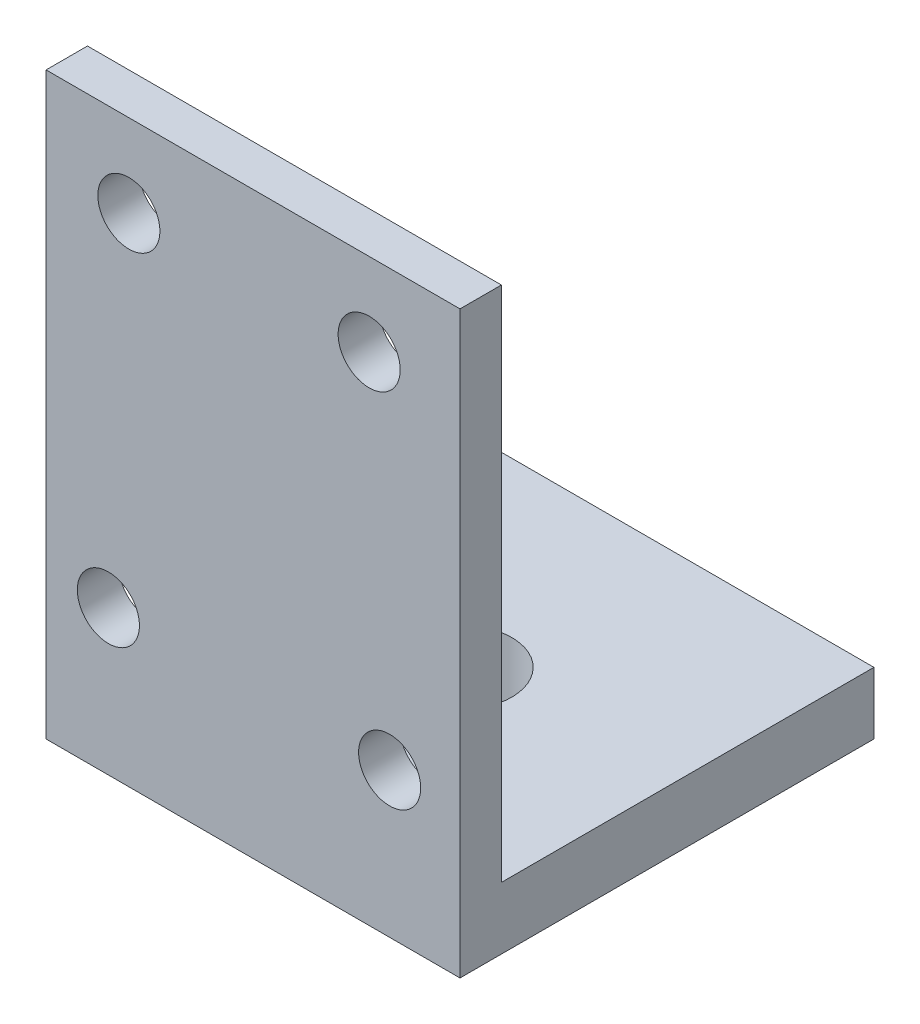
from build123d import *

# Parameters (mm, degrees)
SKETCH1_W           = 20
SKETCH1_H           = 20
SKETCH1_R           = 2.5
BOSS_EXTRUDE1_DEPTH = 3
SKETCH2_W           = 20
SKETCH2_H           = 2
BOSS_EXTRUDE2_DEPTH = 25
SKETCH3_R           = 1.5
CUT_EXTRUDE1_DEPTH  = 25


with BuildPart() as part:
    # Sketch1 → Boss-Extrude1 (new body)
    with BuildSketch(Plane(origin=(0, 0, 0), x_dir=(1, 0, 0), z_dir=(0, 1, 0))):
        with Locations((10, 10)):
            Rectangle(SKETCH1_W, SKETCH1_H)
        with Locations(Location((10, 10, 0), (0, 0, 270))):
            Circle(SKETCH1_R, mode=Mode.SUBTRACT)
    extrude(amount=BOSS_EXTRUDE1_DEPTH)

    # Sketch2 → Boss-Extrude2 (add)
    with BuildSketch(Plane(origin=(0, 3, 0), x_dir=(1, 0, 0), z_dir=(0, 1, 0))):
        with Locations((10, 1)):
            Rectangle(SKETCH2_W, SKETCH2_H)
    extrude(amount=BOSS_EXTRUDE2_DEPTH)

    # Sketch3 → Cut-Extrude1 (cut)
    with BuildSketch(Plane.XY):
        with Locations((4, 24)):
            Circle(SKETCH3_R)
        with Locations((16.6, 7)):
            Circle(SKETCH3_R)
        with Locations((3.010167482, 7)):
            Circle(SKETCH3_R)
        with Locations((15.610167482, 24)):
            Circle(SKETCH3_R)
    extrude(amount=-CUT_EXTRUDE1_DEPTH, mode=Mode.SUBTRACT)


solid = part.part
